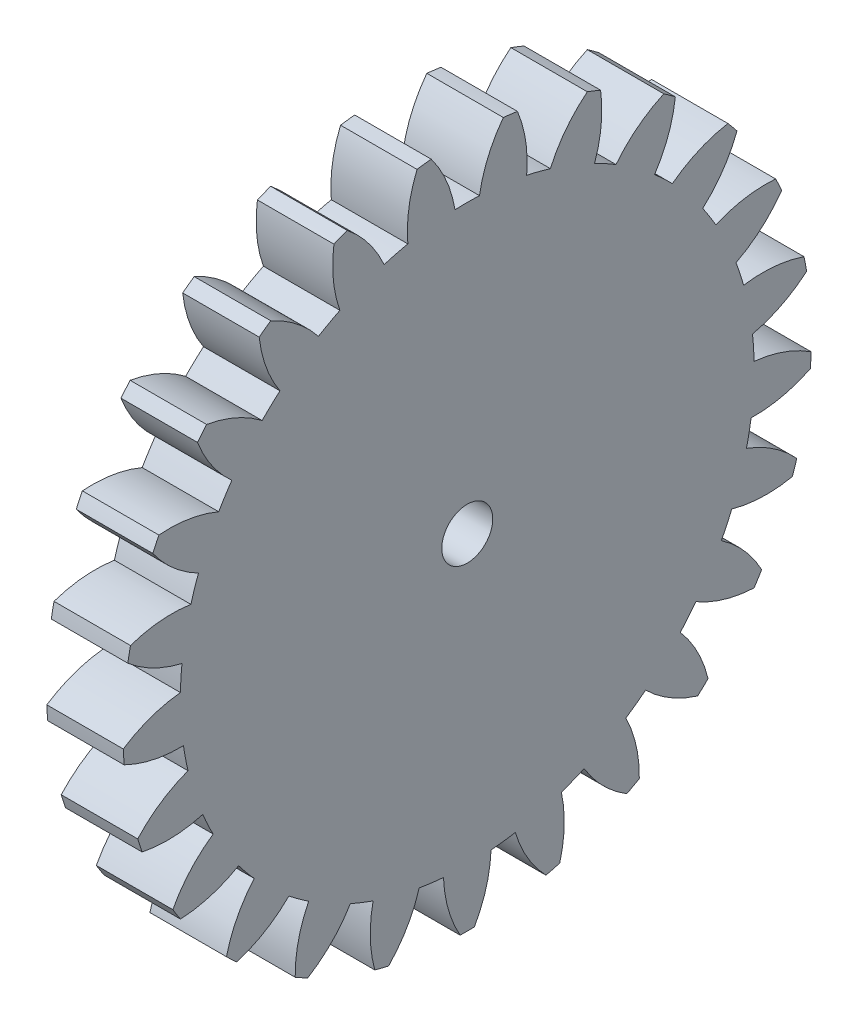
from build123d import *

# Parameters (mm, degrees)
BASPROSKE_W     = 3
BASPROSKE_H     = 13.5
TOOTHCUT_DEPTH  = 20.32614809
TEETHCUTS_COUNT = 25
TEETHCUTS_ANGLE = 345.6
BORSKE_R        = 1
BORE_DEPTH      = 50.0000508


with BuildPart() as part:
    # BasProSke → Base-Revolve (revolve)
    with BuildSketch(Plane(origin=(0, 0, 0), x_dir=(1, 0, 0), z_dir=(0, 1, 0)), mode=Mode.PRIVATE) as base_revolve_sk:
        with Locations((1.5, 6.75)):
            Rectangle(BASPROSKE_W, BASPROSKE_H)
    revolve(base_revolve_sk.sketch.rotate(Axis((-10, 0, 0), (1, 0, 0)), 180), axis=Axis((-10, 0, 0), (1, 0, 0)))

    # TooCutSke → ToothCut (cut, through all)
    with BuildSketch(Plane(origin=(0, 0, 0), x_dir=(0, 0, -1), z_dir=(1, 0, 0))):
        with BuildLine():
            ThreePointArc((0.480087995, 11.238750665), (0, 11.249), (-0.480087995, 11.238750665))
            ThreePointArc((-0.480087995, 11.238750665), (-0.821124963, 12.40220054), (-1.432168974, 13.449361962))
            ThreePointArc((-1.432168974, 13.449361962), (0, 13.5254), (1.432168974, 13.449361962))
            ThreePointArc((1.432168974, 13.449361962), (0.821124963, 12.40220054), (0.480087995, 11.238750665))
        make_face()
    toothcut = extrude(amount=TOOTHCUT_DEPTH, mode=Mode.SUBTRACT)

    # TeethCuts: ToothCut ×25 about axis
    teethcuts_axis = Axis((-10, 0, 0), (1, 0, 0))
    for i in range(1, TEETHCUTS_COUNT):
        add(toothcut.rotate(teethcuts_axis, i * TEETHCUTS_ANGLE / (TEETHCUTS_COUNT - 1)), mode=Mode.SUBTRACT)

    # BorSke → Bore (cut, symmetric)
    with BuildSketch(Plane(origin=(0, 0, 0), x_dir=(0, 0, -1), z_dir=(1, 0, 0))):
        with Locations(Location((0, 0, 0), (0, 0, 180))):
            Circle(BORSKE_R)
    extrude(amount=BORE_DEPTH, both=True, mode=Mode.SUBTRACT)


solid = part.part
